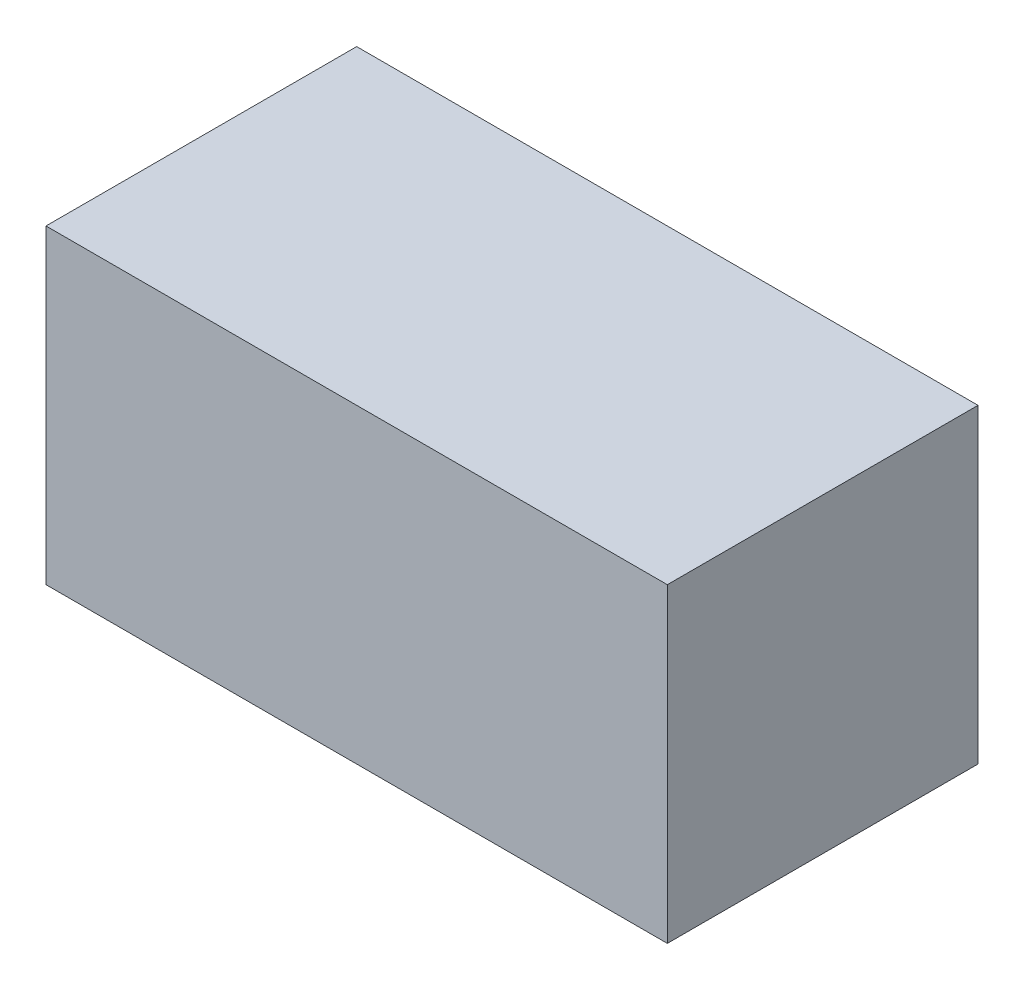
from build123d import *

# Parameters (mm, degrees)
SKETCH_1_W      = 40
SKETCH_1_H      = 20
EXTRUDE_1_DEPTH = 20


with BuildPart() as part:
    # 草图1 → 凸台-拉伸1 (new body)
    with BuildSketch(Plane(origin=(0, 0, 0), x_dir=(1, 0, 0), z_dir=(0, 1, 0))):
        with Locations((20, -10)):
            Rectangle(SKETCH_1_W, SKETCH_1_H)
    extrude(amount=EXTRUDE_1_DEPTH)


solid = part.part
